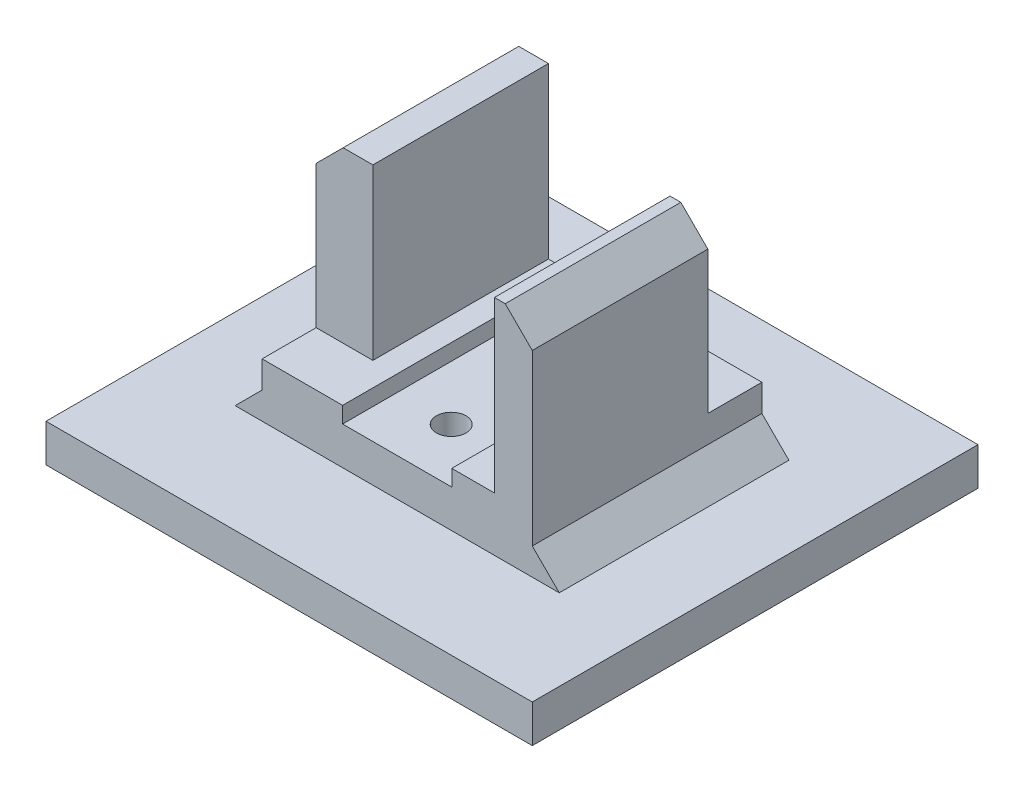
from build123d import *

# Parameters (mm, degrees)
SKETCH1_W           = 42.5
SKETCH1_H           = 11
BOSS_EXTRUDE1_DEPTH = 50
SKETCH2_W           = 82.5
SKETCH2_H           = 4
BOSS_EXTRUDE2_DEPTH = 20
SKETCH3_W           = 82.5
SKETCH3_H           = 4
BOSS_EXTRUDE3_DEPTH = 70
SKETCH4_W           = 10.5
SKETCH4_H           = 34.341245972
SKETCH4_W_2         = 7
BOSS_EXTRUDE4_DEPTH = 42.5
CHAMFER1_SIZE       = 5
SKETCH5_W           = 90
SKETCH5_H           = 82.5
BOSS_EXTRUDE5_DEPTH = 3
SKETCH6_R           = 2.75
CUT_EXTRUDE1_DEPTH  = 118.628081347
SKETCH7_W           = 7.9
SKETCH7_H           = 42.5
SKETCH7_W_2         = 4.4
BOSS_EXTRUDE6_DEPTH = 3
CHAMFER2_SIZE       = 5
CUT_EXTRUDE2_REACH  = 124.45
SKETCH8_W           = 5.5
SKETCH8_H           = 10
SKETCH8_W_2         = 5
SKETCH9_W           = 2
SKETCH9_H           = 10
SKETCH9_W_2         = 5
CUT_EXTRUDE3_DEPTH  = 31.341245972


with BuildPart() as part:
    # Sketch1 → Boss-Extrude1 (new body)
    with BuildSketch(Plane(origin=(0, 0, 0), x_dir=(0, 0, -1), z_dir=(1, 0, 0))):
        with Locations((-46.82408442, -24.747804901)):
            Rectangle(SKETCH1_W, SKETCH1_H)
    extrude(amount=BOSS_EXTRUDE1_DEPTH)

    # Sketch2 → Boss-Extrude2 (add)
    with BuildSketch(Plane.ZY):
        with Locations((46.82408442, -28.247804901)):
            Rectangle(SKETCH2_W, SKETCH2_H)
    extrude(amount=BOSS_EXTRUDE2_DEPTH)

    # Sketch3 → Boss-Extrude3 (add)
    with BuildSketch(Plane(origin=(0, 0, 0), x_dir=(0, 0, -1), z_dir=(1, 0, 0))):
        with Locations((-46.82408442, -28.247804901)):
            Rectangle(SKETCH3_W, SKETCH3_H)
    extrude(amount=BOSS_EXTRUDE3_DEPTH)

    # Sketch4 → Boss-Extrude4 (add)
    with BuildSketch(Plane.XY.offset(68.07408442)):
        with Locations((5.25, -2.077181915)):
            Rectangle(SKETCH4_W, SKETCH4_H)
        with Locations((46.5, -2.077181915)):
            Rectangle(SKETCH4_W_2, SKETCH4_H)
    extrude(amount=-BOSS_EXTRUDE4_DEPTH)

    # Chamfer1
    chamfer1_edges = [part.edges().sort_by_distance(p)[0] for p in [
        (0, -26.247804901, 46.82408442),
        (50, -26.247804901, 46.82408442),
    ]]
    chamfer(chamfer1_edges, length=CHAMFER1_SIZE)

    # Sketch5 → Boss-Extrude5 (add)
    with BuildSketch(Plane.XZ.offset(30.247804901)):
        with Locations((25, 46.82408442)):
            Rectangle(SKETCH5_W, SKETCH5_H)
    extrude(amount=BOSS_EXTRUDE5_DEPTH)

    # Sketch6 → Cut-Extrude1 (cut, through all)
    with BuildSketch(Plane(origin=(0, -19.247804901, 0), x_dir=(1, 0, 0), z_dir=(0, 1, 0))):
        with Locations(Location((25, -36.07408442, 0), (0, 0, 270))):
            Circle(SKETCH6_R)
        with Locations(Location((25, -58.07408442, 0), (0, 0, 270))):
            Circle(SKETCH6_R)
    extrude(amount=-CUT_EXTRUDE1_DEPTH, mode=Mode.SUBTRACT)

    # Sketch7 → Boss-Extrude6 (add)
    with BuildSketch(Plane(origin=(0, -19.247804901, 0), x_dir=(1, 0, 0), z_dir=(0, 1, 0))):
        with Locations((39.05, -46.82408442)):
            Rectangle(SKETCH7_W, SKETCH7_H)
        with Locations((12.7, -46.82408442)):
            Rectangle(SKETCH7_W_2, SKETCH7_H)
    extrude(amount=BOSS_EXTRUDE6_DEPTH)

    # Chamfer2
    chamfer2_edges = [part.edges().sort_by_distance(p)[0] for p in [
        (0, 15.093441071, 46.82408442),
        (50, 15.093441071, 46.82408442),
    ]]
    chamfer(chamfer2_edges, length=CHAMFER2_SIZE)

    # Cut-Extrude2: up to this face of the body (flat: up to its plane)
    cut_extrude2_end = Plane(part.part.faces().sort_by_distance((12.7, -16.247804901, 46.82408442))[0])
    # Sketch8 → Cut-Extrude2 (cut, up to the picked face)
    with BuildSketch(Plane(origin=(0, 15.093441071, 0), x_dir=(1, 0, 0), z_dir=(0, 1, 0)), mode=Mode.PRIVATE) as cut_extrude2_sk1:
        with Locations((7.75, -63.07408442)):
            Rectangle(SKETCH8_W, SKETCH8_H)
    cut_extrude2_tool1 = split(extrude(cut_extrude2_sk1.sketch, amount=-CUT_EXTRUDE2_REACH, mode=Mode.PRIVATE), bisect_by=cut_extrude2_end, keep=Keep.BOTH, mode=Mode.PRIVATE)
    # Sketch8 → Cut-Extrude2 (cut, up to the picked face)
    with BuildSketch(Plane(origin=(0, 15.093441071, 0), x_dir=(1, 0, 0), z_dir=(0, 1, 0)), mode=Mode.PRIVATE) as cut_extrude2_sk2:
        with Locations((47.5, -30.57408442)):
            Rectangle(SKETCH8_W_2, SKETCH8_H)
    cut_extrude2_tool2 = split(extrude(cut_extrude2_sk2.sketch, amount=-CUT_EXTRUDE2_REACH, mode=Mode.PRIVATE), bisect_by=cut_extrude2_end, keep=Keep.BOTH, mode=Mode.PRIVATE)
    add(cut_extrude2_tool1.solids().sort_by(Axis((7.75, 15.093441, 63.074084), (0, -1, 0)))[0], mode=Mode.SUBTRACT)
    add(cut_extrude2_tool2.solids().sort_by(Axis((47.5, 15.093441, 30.574084), (0, -1, 0)))[0], mode=Mode.SUBTRACT)

    # Sketch9 → Cut-Extrude3 (cut)
    with BuildSketch(Plane(origin=(0, 15.093441071, 0), x_dir=(1, 0, 0), z_dir=(0, 1, 0))):
        with Locations((44, -30.57408442)):
            Rectangle(SKETCH9_W, SKETCH9_H)
        with Locations((2.5, -63.07408442)):
            Rectangle(SKETCH9_W_2, SKETCH9_H)
    extrude(amount=-CUT_EXTRUDE3_DEPTH, mode=Mode.SUBTRACT)


solid = part.part
